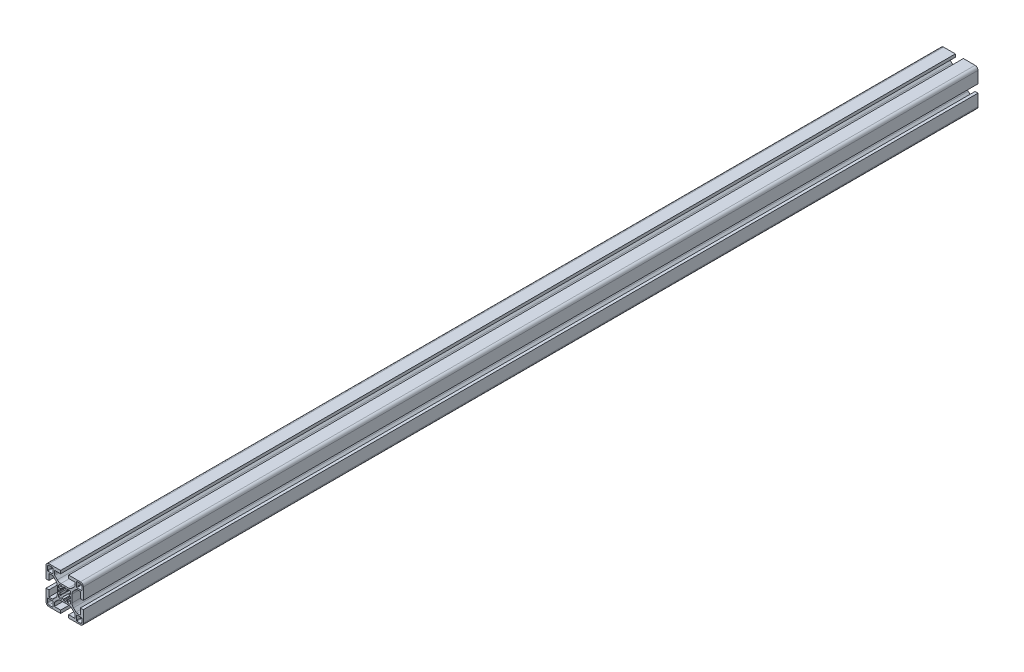
from build123d import *

# Parameters (mm, degrees)
SKETCH1_R           = 5
BOSS_EXTRUDE1_DEPTH = 914.4
CUT_EXTRUDE1_DEPTH  = 6000
CUT_EXTRUDE2_DEPTH  = 6000
CUT_EXTRUDE3_DEPTH  = 6000
CUT_EXTRUDE4_DEPTH  = 6000
CUT_EXTRUDE5_DEPTH  = 6000


with BuildPart() as part:
    # Sketch1 → Boss-Extrude1 (new body)
    with BuildSketch(Plane.XY):
        with BuildLine():
            Line((-19.05, -4.1), (-19.05, -16.05))
            ThreePointArc((-19.05, -16.05), (-18.171320344, -18.171320344), (-16.05, -19.05))
            Line((-16.05, -19.05), (-4.1, -19.05))
            Line((-4.1, -19.05), (-4.1, -16.05))
            Line((-4.1, -16.05), (-10.5, -16.05))
            Line((-10.5, -16.05), (-10.5, -12.7127))
            ThreePointArc((-10.5, -12.7127), (-10.378208373, -12.100409218), (-10.03135, -11.58135))
            Line((-10.03135, -11.58135), (-7.464465, -9.014465))
            ThreePointArc((-7.464465, -9.014465), (-5.842347304, -7.930602396), (-3.92893, -7.55))
            Line((-3.92893, -7.55), (3.92893, -7.55))
            ThreePointArc((3.92893, -7.55), (5.842347304, -7.930602396), (7.464465, -9.014465))
            Line((7.464465, -9.014465), (10.03135, -11.58135))
            ThreePointArc((10.03135, -11.58135), (10.378208373, -12.100409218), (10.5, -12.7127))
            Line((10.5, -12.7127), (10.5, -16.05))
            Line((10.5, -16.05), (4.1, -16.05))
            Line((4.1, -16.05), (4.1, -19.05))
            Line((4.1, -19.05), (16.05, -19.05))
            ThreePointArc((16.05, -19.05), (18.171320344, -18.171320344), (19.05, -16.05))
            Line((19.05, -16.05), (19.05, -4.1))
            Line((19.05, -4.1), (16.05, -4.1))
            Line((16.05, -4.1), (16.05, -10.5))
            Line((16.05, -10.5), (12.7127, -10.5))
            ThreePointArc((12.7127, -10.5), (12.100409218, -10.378208373), (11.58135, -10.03135))
            Line((11.58135, -10.03135), (9.014465, -7.464465))
            ThreePointArc((9.014465, -7.464465), (7.930602396, -5.842347304), (7.55, -3.92893))
            Line((7.55, -3.92893), (7.55, 3.92893))
            ThreePointArc((7.55, 3.92893), (7.930602396, 5.842347304), (9.014465, 7.464465))
            Line((9.014465, 7.464465), (11.58135, 10.03135))
            ThreePointArc((11.58135, 10.03135), (12.100409218, 10.378208373), (12.7127, 10.5))
            Line((12.7127, 10.5), (16.05, 10.5))
            Line((16.05, 10.5), (16.05, 4.1))
            Line((16.05, 4.1), (19.05, 4.1))
            Line((19.05, 4.1), (19.05, 16.05))
            ThreePointArc((19.05, 16.05), (18.171320344, 18.171320344), (16.05, 19.05))
            Line((16.05, 19.05), (4.1, 19.05))
            Line((4.1, 19.05), (4.1, 16.05))
            Line((4.1, 16.05), (10.5, 16.05))
            Line((10.5, 16.05), (10.5, 12.7127))
            ThreePointArc((10.5, 12.7127), (10.378208373, 12.100409218), (10.03135, 11.58135))
            Line((10.03135, 11.58135), (7.464465, 9.014465))
            ThreePointArc((7.464465, 9.014465), (5.842347304, 7.930602396), (3.92893, 7.55))
            Line((3.92893, 7.55), (-3.92893, 7.55))
            ThreePointArc((-3.92893, 7.55), (-5.842347304, 7.930602396), (-7.464465, 9.014465))
            Line((-7.464465, 9.014465), (-10.03135, 11.58135))
            ThreePointArc((-10.03135, 11.58135), (-10.378208373, 12.100409218), (-10.5, 12.7127))
            Line((-10.5, 12.7127), (-10.5, 16.05))
            Line((-10.5, 16.05), (-4.1, 16.05))
            Line((-4.1, 16.05), (-4.1, 19.05))
            Line((-4.1, 19.05), (-16.05, 19.05))
            ThreePointArc((-16.05, 19.05), (-18.171320344, 18.171320344), (-19.05, 16.05))
            Line((-19.05, 16.05), (-19.05, 4.1))
            Line((-19.05, 4.1), (-16.05, 4.1))
            Line((-16.05, 4.1), (-16.05, 10.5))
            Line((-16.05, 10.5), (-12.7127, 10.5))
            ThreePointArc((-12.7127, 10.5), (-12.100409218, 10.378208373), (-11.58135, 10.03135))
            Line((-11.58135, 10.03135), (-9.014465, 7.464465))
            ThreePointArc((-9.014465, 7.464465), (-7.930602396, 5.842347304), (-7.55, 3.92893))
            Line((-7.55, 3.92893), (-7.55, -3.92893))
            ThreePointArc((-7.55, -3.92893), (-7.930602396, -5.842347304), (-9.014465, -7.464465))
            Line((-9.014465, -7.464465), (-11.58135, -10.03135))
            ThreePointArc((-11.58135, -10.03135), (-12.100409218, -10.378208373), (-12.7127, -10.5))
            Line((-12.7127, -10.5), (-16.05, -10.5))
            Line((-16.05, -10.5), (-16.05, -4.1))
            Line((-16.05, -4.1), (-19.05, -4.1))
        make_face()
        Circle(SKETCH1_R, mode=Mode.SUBTRACT)
    extrude(amount=-BOSS_EXTRUDE1_DEPTH)

    # Sketch2 → Cut-Extrude1 (cut)
    with BuildSketch(Plane.XY):
        with BuildLine():
            Line((-17.55, -12.5), (-17.55, -16.05))
            ThreePointArc((-17.55, -16.05), (-17.110660172, -17.110660172), (-16.05, -17.55))
            Line((-16.05, -17.55), (-12.5, -17.55))
            ThreePointArc((-12.5, -17.55), (-12.146446609, -17.403553391), (-12, -17.05))
            Line((-12, -17.05), (-12, -12.5))
            ThreePointArc((-12, -12.5), (-12.146446609, -12.146446609), (-12.5, -12))
            Line((-12.5, -12), (-17.05, -12))
            ThreePointArc((-17.05, -12), (-17.403553391, -12.146446609), (-17.55, -12.5))
        make_face()
    extrude(amount=-CUT_EXTRUDE1_DEPTH, mode=Mode.SUBTRACT)

    # Sketch3 → Cut-Extrude2 (cut)
    with BuildSketch(Plane.XY):
        with BuildLine():
            Line((12.5, -17.55), (16.05, -17.55))
            ThreePointArc((16.05, -17.55), (17.110660172, -17.110660172), (17.55, -16.05))
            Line((17.55, -16.05), (17.55, -12.5))
            ThreePointArc((17.55, -12.5), (17.403553391, -12.146446609), (17.05, -12))
            Line((17.05, -12), (12.5, -12))
            ThreePointArc((12.5, -12), (12.146446609, -12.146446609), (12, -12.5))
            Line((12, -12.5), (12, -17.05))
            ThreePointArc((12, -17.05), (12.146446609, -17.403553391), (12.5, -17.55))
        make_face()
    extrude(amount=-CUT_EXTRUDE2_DEPTH, mode=Mode.SUBTRACT)

    # Sketch4 → Cut-Extrude3 (cut)
    with BuildSketch(Plane.XY):
        with BuildLine():
            Line((-6.05, 1.06724), (-6.05, -1.19102))
            Line((-6.05, -1.19102), (-4.85654377, -1.189110006))
            ThreePointArc((-4.85654377, -1.189110006), (-4.594960171, -1.971380488), (-4.208325083, -2.7))
            Line((-4.208325083, -2.7), (-6.05, -2.7))
            Line((-6.05, -2.7), (-6.05, -5.05))
            ThreePointArc((-6.05, -5.05), (-5.757106781, -5.757106781), (-5.05, -6.05))
            Line((-5.05, -6.05), (-2.7, -6.05))
            Line((-2.7, -6.05), (-2.7, -4.208325083))
            ThreePointArc((-2.7, -4.208325083), (-1.952880863, -4.602853064), (-1.15, -4.865953144))
            Line((-1.15, -4.865953144), (-1.15, -6.05))
            Line((-1.15, -6.05), (1.15, -6.05))
            Line((1.15, -6.05), (1.15, -4.865953144))
            ThreePointArc((1.15, -4.865953144), (1.952880863, -4.602853064), (2.7, -4.208325083))
            Line((2.7, -4.208325083), (2.7, -6.05))
            Line((2.7, -6.05), (5.05, -6.05))
            ThreePointArc((5.05, -6.05), (5.757106781, -5.757106781), (6.05, -5.05))
            Line((6.05, -5.05), (6.05, -2.7))
            Line((6.05, -2.7), (4.208325083, -2.7))
            ThreePointArc((4.208325083, -2.7), (4.598107084, -1.964029338), (4.860322362, -1.173569996))
            Line((4.860322362, -1.173569996), (6.05, -1.17167))
            Line((6.05, -1.17167), (6.05, 1.10628))
            Line((6.05, 1.10628), (4.876934876, 1.102499983))
            ThreePointArc((4.876934876, 1.102499983), (4.612319233, 1.930417389), (4.208325083, 2.7))
            Line((4.208325083, 2.7), (6.05, 2.7))
            Line((6.05, 2.7), (6.05, 5.05))
            ThreePointArc((6.05, 5.05), (5.757106781, 5.757106781), (5.05, 6.05))
            Line((5.05, 6.05), (2.7, 6.05))
            Line((2.7, 6.05), (2.7, 4.208325083))
            ThreePointArc((2.7, 4.208325083), (1.952880863, 4.602853064), (1.15, 4.865953144))
            Line((1.15, 4.865953144), (1.15, 6.05))
            Line((1.15, 6.05), (-1.15, 6.05))
            Line((-1.15, 6.05), (-1.15, 4.865953144))
            ThreePointArc((-1.15, 4.865953144), (-1.952880863, 4.602853064), (-2.7, 4.208325083))
            Line((-2.7, 4.208325083), (-2.7, 6.05))
            Line((-2.7, 6.05), (-5.05, 6.05))
            ThreePointArc((-5.05, 6.05), (-5.757106781, 5.757106781), (-6.05, 5.05))
            Line((-6.05, 5.05), (-6.05, 2.7))
            Line((-6.05, 2.7), (-4.208325083, 2.7))
            ThreePointArc((-4.208325083, 2.7), (-4.618524958, 1.9155227), (-4.883949119, 1.071000003))
            Line((-4.883949119, 1.071000003), (-6.05, 1.06724))
        make_face()
    extrude(amount=-CUT_EXTRUDE3_DEPTH, mode=Mode.SUBTRACT)

    # Sketch5 → Cut-Extrude4 (cut)
    with BuildSketch(Plane.XY):
        with BuildLine():
            Line((12, 17.05), (12, 12.5))
            ThreePointArc((12, 12.5), (12.146446609, 12.146446609), (12.5, 12))
            Line((12.5, 12), (17.05, 12))
            ThreePointArc((17.05, 12), (17.403553391, 12.146446609), (17.55, 12.5))
            Line((17.55, 12.5), (17.55, 16.05))
            ThreePointArc((17.55, 16.05), (17.110660172, 17.110660172), (16.05, 17.55))
            Line((16.05, 17.55), (12.5, 17.55))
            ThreePointArc((12.5, 17.55), (12.146446609, 17.403553391), (12, 17.05))
        make_face()
    extrude(amount=-CUT_EXTRUDE4_DEPTH, mode=Mode.SUBTRACT)

    # Sketch6 → Cut-Extrude5 (cut)
    with BuildSketch(Plane.XY):
        with BuildLine():
            Line((-17.05, 12), (-12.5, 12))
            ThreePointArc((-12.5, 12), (-12.146446609, 12.146446609), (-12, 12.5))
            Line((-12, 12.5), (-12, 17.05))
            ThreePointArc((-12, 17.05), (-12.146446609, 17.403553391), (-12.5, 17.55))
            Line((-12.5, 17.55), (-16.05, 17.55))
            ThreePointArc((-16.05, 17.55), (-17.110660172, 17.110660172), (-17.55, 16.05))
            Line((-17.55, 16.05), (-17.55, 12.5))
            ThreePointArc((-17.55, 12.5), (-17.403553391, 12.146446609), (-17.05, 12))
        make_face()
    extrude(amount=-CUT_EXTRUDE5_DEPTH, mode=Mode.SUBTRACT)

    # Sketch7 → Hole Wizard 3230 (revolve, cut)
    with BuildSketch(Plane(origin=(-20.05, 0, -33), x_dir=(0, 0, 1), z_dir=(0, 1, 0))):
        Polygon((0, 0), (0, 25), (5.75, 25), (5.75, 24.850000278), (6.6, 24), (6.6, 0), align=None)
    revolve(axis=Axis((-26.180023899, 0, -33), (1, 0, 0)), mode=Mode.SUBTRACT)

    # Sketch9 → Hole2 (revolve, cut)
    with BuildSketch(Plane(origin=(-20.05, 0, -500.4), x_dir=(0, 0, 1), z_dir=(0, 1, 0))):
        Polygon((0, 0), (0, 25), (5.75, 25), (5.75, 24.850000278), (6.6, 24), (6.6, 0), align=None)
    revolve(axis=Axis((-26.180023899, 0, -500.4), (1, 0, 0)), mode=Mode.SUBTRACT)


solid = part.part
